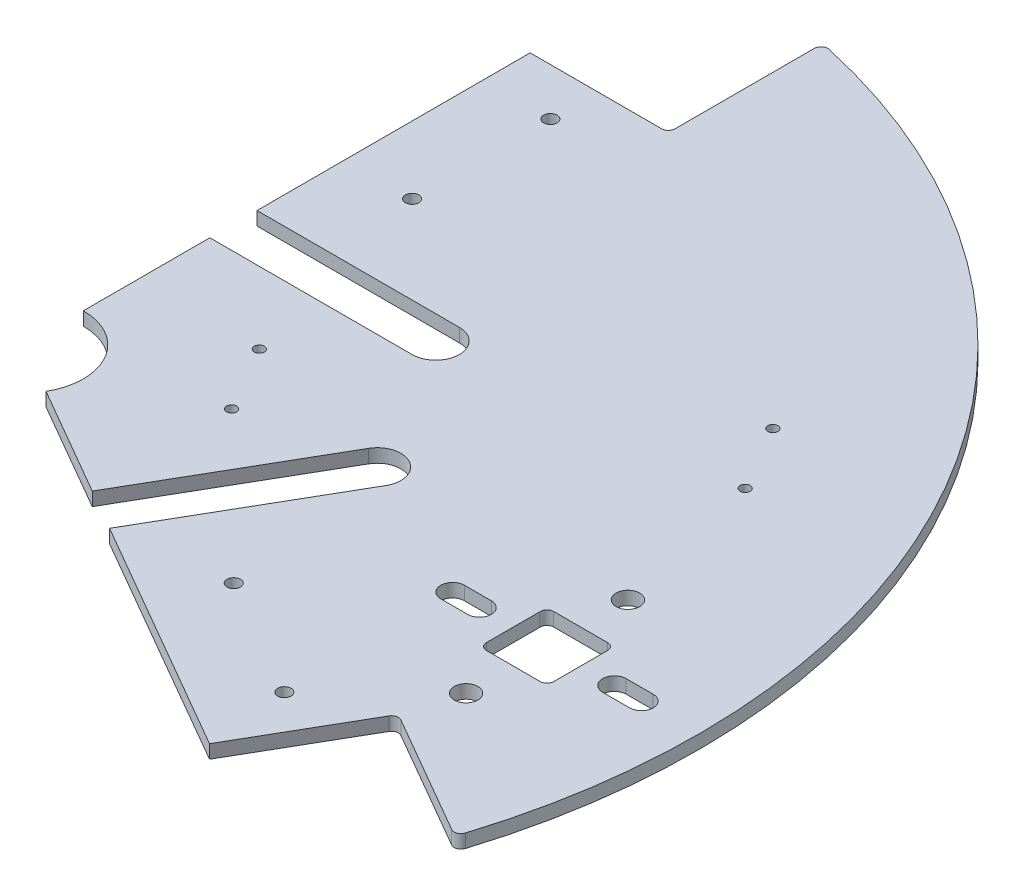
from build123d import *

# Parameters (mm, degrees)
BOSS_EXTRUDE1_DEPTH = 4
SKETCH2_R           = 2
CUT_EXTRUDE1_DEPTH  = 4
SKETCH3_R           = 1.5
CUT_EXTRUDE2_DEPTH  = 4
CUT_EXTRUDE3_DEPTH  = 4
SKETCH5_R           = 2
CUT_EXTRUDE4_DEPTH  = 4
SKETCH6_R           = 3.5
SKETCH6_W           = 20
SKETCH6_H           = 20
CUT_EXTRUDE5_DEPTH  = 4
CUT_EXTRUDE6_DEPTH  = 4
SKETCH9_R           = 17.5
CUT_EXTRUDE7_DEPTH  = 4
FILLET1_R           = 2


with BuildPart() as part:
    # Sketch1 → Boss-Extrude1 (new body)
    with BuildSketch(Plane(origin=(0, 0, 0), x_dir=(1, 0, 0), z_dir=(0, 1, 0))):
        with BuildLine():
            Line((0, 0), (0, -150))
            Line((0, -150), (129.903810568, -225))
            Line((129.903810568, -225), (150.403810568, -189.492958445))
            Line((150.403810568, -189.492958445), (190.024472791, -212.367958445))
            ThreePointArc((190.024472791, -212.367958445), (173.202037288, -50.001757147), (41, 45.75))
            Line((41, 45.75), (41, 0))
            Line((41, 0), (0, 0))
        make_face()
    extrude(amount=BOSS_EXTRUDE1_DEPTH)

    # Sketch2 → Cut-Extrude1 (cut)
    with BuildSketch(Plane(origin=(0, 4, 0), x_dir=(1, 0, 0), z_dir=(0, 1, 0))):
        with Locations(Location((20, -14, 0), (0, 0, 270))):
            Circle(SKETCH2_R)
        with Locations(Location((20, -55, 0), (0, 0, 270))):
            Circle(SKETCH2_R)
    extrude(amount=-CUT_EXTRUDE1_DEPTH, mode=Mode.SUBTRACT)

    # Sketch3 → Cut-Extrude2 (cut)
    with BuildSketch(Plane(origin=(0, 4, 0), x_dir=(1, 0, 0), z_dir=(0, 1, 0))):
        with Locations(Location((143.756051904, -79.992785793, 0), (0, 0, 270))):
            Circle(SKETCH3_R)
        with Locations(Location((132.506051904, -60.507214207, 0), (0, 0, 270))):
            Circle(SKETCH3_R)
        with Locations(Location((47.194219382, -135.742785793, 0), (0, 0, 270))):
            Circle(SKETCH3_R)
        with Locations(Location((35.944219382, -116.257214207, 0), (0, 0, 270))):
            Circle(SKETCH3_R)
    extrude(amount=-CUT_EXTRUDE2_DEPTH, mode=Mode.SUBTRACT)

    # Sketch4 → Cut-Extrude3 (cut)
    with BuildSketch(Plane(origin=(0, 4, 0), x_dir=(1, 0, 0), z_dir=(0, 1, 0))):
        with BuildLine():
            Line((0, -81), (0, -95))
            Line((0, -95), (60, -95))
            ThreePointArc((60, -95), (67, -88), (60, -81))
            Line((60, -81), (0, -81))
        make_face()
    extrude(amount=-CUT_EXTRUDE3_DEPTH, mode=Mode.SUBTRACT)

    # Sketch5 → Cut-Extrude4 (cut)
    with BuildSketch(Plane(origin=(0, 4, 0), x_dir=(1, 0, 0), z_dir=(0, 1, 0))):
        with Locations(Location((127.779454915, -200.679491924, 0), (0, 0, 270))):
            Circle(SKETCH5_R)
        with Locations(Location((92.27241336, -180.179491924, 0), (0, 0, 270))):
            Circle(SKETCH5_R)
    extrude(amount=-CUT_EXTRUDE4_DEPTH, mode=Mode.SUBTRACT)

    # Sketch6 → Cut-Extrude5 (cut)
    with BuildSketch(Plane(origin=(0, 4, 0), x_dir=(1, 0, 0), z_dir=(0, 1, 0))):
        with Locations(Location((155, -174, 0), (0, 0, 270))):
            Circle(SKETCH6_R)
        with Locations(Location((155, -126, 0), (0, 0, 90))):
            Circle(SKETCH6_R)
        with Locations((155, -150)):
            Rectangle(SKETCH6_W, SKETCH6_H)
        with BuildLine():
            Line((127, -146.5), (135, -146.5))
            ThreePointArc((135, -146.5), (138.5, -150), (135, -153.5))
            Line((135, -153.5), (127, -153.5))
            ThreePointArc((127, -153.5), (123.5, -150), (127, -146.5))
        make_face()
        with BuildLine():
            Line((183, -146.5), (175, -146.5))
            ThreePointArc((175, -146.5), (171.5, -150), (175, -153.5))
            Line((175, -153.5), (183, -153.5))
            ThreePointArc((183, -153.5), (186.5, -150), (183, -146.5))
        make_face()
    extrude(amount=-CUT_EXTRUDE5_DEPTH, mode=Mode.SUBTRACT)

    # Sketch8 → Cut-Extrude6 (cut)
    with BuildSketch(Plane(origin=(0, 4, 0), x_dir=(1, 0, 0), z_dir=(0, 1, 0))):
        with BuildLine():
            Line((47.631397208, -177.5), (59.755752861, -184.5))
            Line((59.755752861, -184.5), (89.755752861, -132.538475773))
            ThreePointArc((89.755752861, -132.538475773), (87.193575035, -122.976297946), (77.631397208, -125.538475773))
            Line((77.631397208, -125.538475773), (47.631397208, -177.5))
        make_face()
    extrude(amount=-CUT_EXTRUDE6_DEPTH, mode=Mode.SUBTRACT)

    # Sketch9 → Cut-Extrude7 (cut)
    with BuildSketch(Plane(origin=(0, 4, 0), x_dir=(1, 0, 0), z_dir=(0, 1, 0))):
        with Locations((0, -150)):
            Circle(SKETCH9_R)
    extrude(amount=-CUT_EXTRUDE7_DEPTH, mode=Mode.SUBTRACT)

    # Fillet1
    fillet1_edges = [part.edges().sort_by_distance(p)[0] for p in [
        (165, 2, 160),
        (165, 2, 140),
        (145, 2, 140),
        (145, 2, 160),
        (41, 2, 0),
        (41, 2, -45.75),
        (190.024472791, 2, 212.367958445),
        (150.403810568, 2, 189.492958445),
    ]]
    fillet(fillet1_edges, radius=FILLET1_R)


solid = part.part
